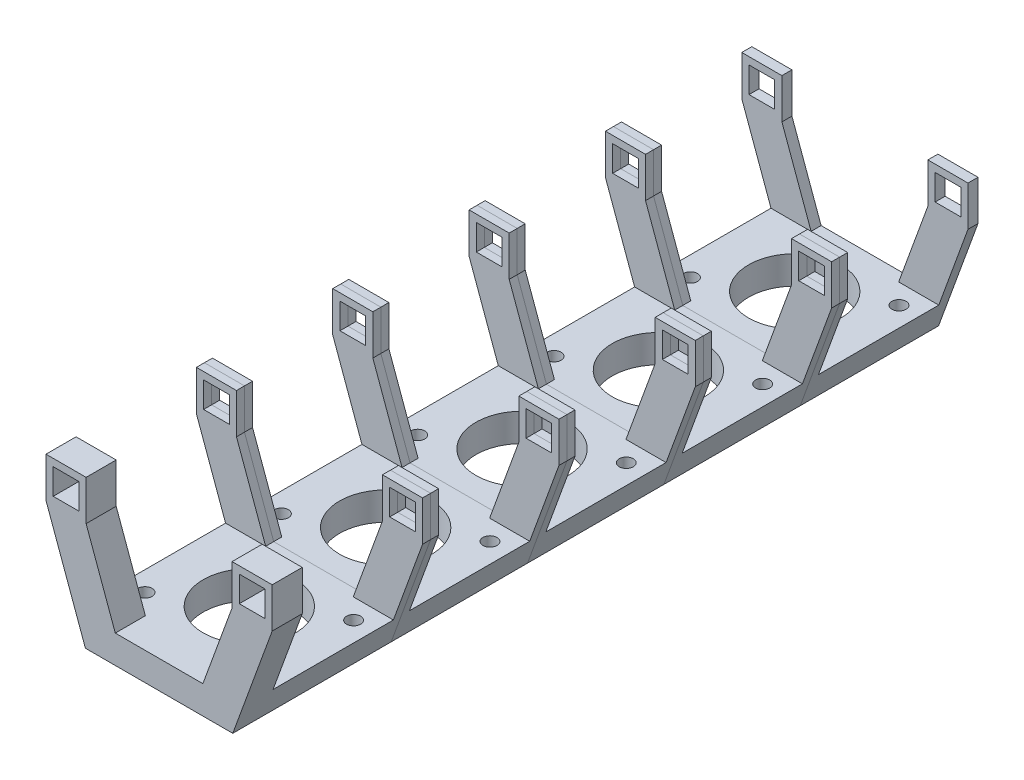
from build123d import *

# Parameters (mm, degrees)
SKETCH3_W           = 6.4
SKETCH3_H           = 6.4
BOSS_EXTRUDE1_DEPTH = 2
BOSS_EXTRUDE2_DEPTH = 30
SKETCH4_W           = 6.4
SKETCH4_H           = 6.4
BOSS_EXTRUDE6_DEPTH = 2
LPATTERN7_COUNT     = 5
LPATTERN7_PITCH     = 34
SKETCH12_W          = 6.4
SKETCH12_H          = 6.4
BOSS_EXTRUDE7_DEPTH = 0.5
SKETCH13_W          = 6.4
SKETCH13_H          = 6.4
BOSS_EXTRUDE8_DEPTH = 2
SKETCH15_R          = 11.5
SKETCH15_R_2        = 1.75
CUT_EXTRUDE5_DEPTH  = 7
LPATTERN8_COUNT     = 5
LPATTERN8_PITCH     = 34
SKETCH16_W          = 6.4
SKETCH16_H          = 6.4
BOSS_EXTRUDE9_DEPTH = 3.5


with BuildPart() as part:
    # Sketch3 → Boss-Extrude1 (new body)
    # profile 1 of 3: a face of its own
    with BuildSketch(Plane.XY):
        Polygon((5, 5), (-5, 5), (-5, -5), (2.279404685, -25), (12.279404685, -25), (5, -5), align=None)
        Rectangle(SKETCH3_W, SKETCH3_H, mode=Mode.SUBTRACT)
    # profile 2 of 3: a face of its own
    with BuildSketch(Plane.XY):
        Polygon((41.4, -5), (34.120595315, -25), (44.120595315, -25), (51.4, -5), (51.4, 5), (41.4, 5), align=None)
        with Locations((46.4, 0)):
            Rectangle(SKETCH3_W, SKETCH3_H, mode=Mode.SUBTRACT)
    # profile 3 of 3: a face of its own
    with BuildSketch(Plane.XY):
        Polygon((12.279404685, -25), (2.279404685, -25), (4.827196325, -32), (41.572803675, -32), (44.120595315, -25), (34.120595315, -25), align=None)
    extrude(amount=BOSS_EXTRUDE1_DEPTH)

    # Sketch3<4> → Boss-Extrude2 (add)
    with BuildSketch(Plane.XY):
        Polygon((12.279404685, -25), (2.279404685, -25), (4.827196325, -32), (41.572803675, -32), (44.120595315, -25), (34.120595315, -25), align=None)
    extrude(amount=-BOSS_EXTRUDE2_DEPTH)

    # Sketch4 → Boss-Extrude6 (add)
    with BuildSketch(Plane(origin=(0, 0, -30), x_dir=(-1, 0, 0), z_dir=(0, 0, -1))):
        Polygon((5, -5), (5, 5), (-5, 5), (-5, -5), (-12.279404685, -25), (-34.120595315, -25), (-41.4, -5), (-41.4, 5), (-51.4, 5), (-51.4, -5), (-44.120595315, -25), (-41.572803675, -32), (-4.827196325, -32), (-2.279404685, -25), align=None)
        Rectangle(SKETCH4_W, SKETCH4_H, mode=Mode.SUBTRACT)
        with Locations((-46.4, 0)):
            Rectangle(SKETCH4_W, SKETCH4_H, mode=Mode.SUBTRACT)
    extrude(amount=BOSS_EXTRUDE6_DEPTH)


with BuildPart() as lpattern7_1:
    # LPattern7: pattern copy
    add(part.part.moved(Location(Vector(0, 0, 1) * (1 * LPATTERN7_PITCH))))


with BuildPart() as lpattern7_2:
    # LPattern7: pattern copy
    add(part.part.moved(Location(Vector(0, 0, 1) * (2 * LPATTERN7_PITCH))))


with BuildPart() as lpattern7_3:
    # LPattern7: pattern copy
    add(part.part.moved(Location(Vector(0, 0, 1) * (3 * LPATTERN7_PITCH))))


with BuildPart() as lpattern7_4:
    # LPattern7: pattern copy
    add(part.part.moved(Location(Vector(0, 0, 1) * (4 * LPATTERN7_PITCH))))

    # Sketch13 → Boss-Extrude8 (add)
    with BuildSketch(Plane.XY.offset(138)):
        Polygon((41.4, -5), (41.4, 5), (51.4, 5), (51.4, -5), (41.572803675, -32), (4.827196325, -32), (-5, -5), (-5, 5), (5, 5), (5, -5), (12.279404685, -25), (34.120595315, -25), align=None)
        with Locations((46.4, 0)):
            Rectangle(SKETCH13_W, SKETCH13_H, mode=Mode.SUBTRACT)
        Rectangle(SKETCH13_W, SKETCH13_H, mode=Mode.SUBTRACT)
    extrude(amount=BOSS_EXTRUDE8_DEPTH)

    # Sketch15 → Cut-Extrude5 (cut)
    with BuildSketch(Plane(origin=(0, -25, 0), x_dir=(1, 0, 0), z_dir=(0, 1, 0))):
        with Locations(Location((23.2, -121, 0), (0, 0, 270))):
            Circle(SKETCH15_R)
        with Locations(Location((7.2, -131, 0), (0, 0, 270))):
            Circle(SKETCH15_R_2)
        with Locations(Location((39.2, -111, 0), (0, 0, 270))):
            Circle(SKETCH15_R_2)
    cut_extrude5 = extrude(amount=-CUT_EXTRUDE5_DEPTH, mode=Mode.SUBTRACT)

    # Sketch16 → Boss-Extrude9 (add)
    with BuildSketch(Plane.XY.offset(140)):
        Polygon((41.572803675, -32), (51.4, -5), (51.4, 5), (41.4, 5), (41.4, -5), (34.120595315, -25), (12.279404685, -25), (5, -5), (5, 5), (-5, 5), (-5, -5), (4.827196325, -32), align=None)
        with Locations((46.4, 0)):
            Rectangle(SKETCH16_W, SKETCH16_H, mode=Mode.SUBTRACT)
        Rectangle(SKETCH16_W, SKETCH16_H, mode=Mode.SUBTRACT)
    extrude(amount=BOSS_EXTRUDE9_DEPTH)


with BuildPart() as part_1:
    add(part.part)

    # Sketch12 → Boss-Extrude7 (add)
    with BuildSketch(Plane(origin=(0, 0, -32), x_dir=(-1, 0, 0), z_dir=(0, 0, -1))):
        Polygon((-5, 5), (-5, -5), (-12.279404685, -25), (-34.120595315, -25), (-41.4, -5), (-41.4, 5), (-51.4, 5), (-51.4, -5), (-41.572803675, -32), (-4.827196325, -32), (5, -5), (5, 5), align=None)
        Rectangle(SKETCH12_W, SKETCH12_H, mode=Mode.SUBTRACT)
        with Locations((-46.4, 0)):
            Rectangle(SKETCH12_W, SKETCH12_H, mode=Mode.SUBTRACT)
    extrude(amount=BOSS_EXTRUDE7_DEPTH)


with BuildPart() as lpattern8_tool:
    # LPattern8: Cut-Extrude5 ×5
    with Locations(*[(0, 0, -i * LPATTERN8_PITCH) for i in range(1, LPATTERN8_COUNT)]):
        add(cut_extrude5)


with BuildPart() as part_2:
    add(part_1.part)

    # LPattern8: cut by lpattern8_tool
    add(lpattern8_tool.part, mode=Mode.SUBTRACT)


with BuildPart() as lpattern7_1_1:
    add(lpattern7_1.part)

    # LPattern8: cut by lpattern8_tool
    add(lpattern8_tool.part, mode=Mode.SUBTRACT)


with BuildPart() as lpattern7_2_1:
    add(lpattern7_2.part)

    # LPattern8: cut by lpattern8_tool
    add(lpattern8_tool.part, mode=Mode.SUBTRACT)


with BuildPart() as lpattern7_3_1:
    add(lpattern7_3.part)

    # LPattern8: cut by lpattern8_tool
    add(lpattern8_tool.part, mode=Mode.SUBTRACT)


solid = Compound([lpattern7_4.part, part_2.part, lpattern7_1_1.part, lpattern7_2_1.part, lpattern7_3_1.part])
